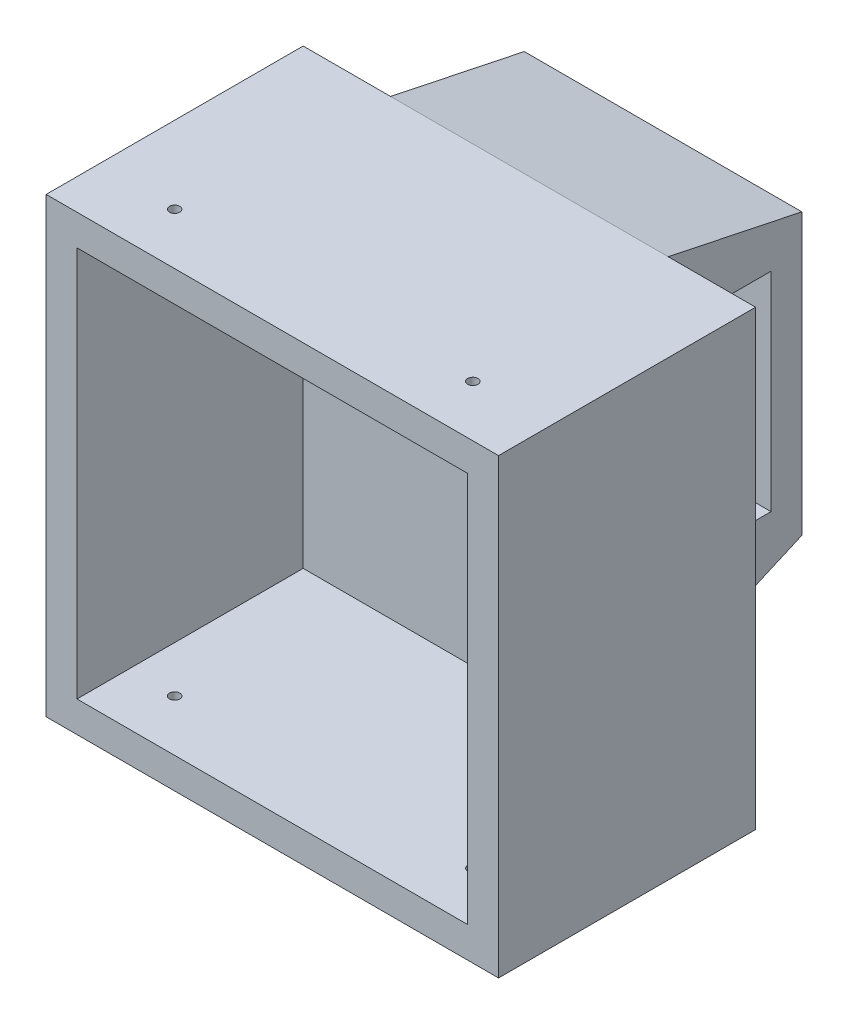
from build123d import *

# Parameters (mm, degrees)
ESQUISSE1_W             = 76
ESQUISSE1_H             = 76
BOSS_EXTRU_1_DEPTH      = 6
ESQUISSE3_W             = 76
ESQUISSE3_H             = 50
BOSS_EXTRU_2_DEPTH      = 6
ESQUISSE4_W             = 50
ESQUISSE4_H             = 82
BOSS_EXTRU_3_DEPTH      = 6
ESQUISSE5_W             = 50
ESQUISSE5_H             = 82
BOSS_EXTRU_4_DEPTH      = 6
ESQUISSE6_W             = 88
ESQUISSE6_H             = 50
BOSS_EXTRU_5_DEPTH      = 6
ESQUISSE8_W             = 54
ESQUISSE8_H             = 7
BOSS_EXTRU_6_DEPTH      = 26
ESQUISSE9_W             = 54
ESQUISSE9_H             = 6
BOSS_EXTRU_7_DEPTH      = 40.5
ESQUISSE11_W            = 54
ESQUISSE11_H            = 7
BOSS_EXTRU_8_DEPTH      = 26
BOSS_EXTRU_10_DEPTH     = 54
ESQUISSE13_R            = 1
ENL_V_MAT_EXTRU_1_DEPTH = 100


with BuildPart() as part:
    # Esquisse1 → Boss.-Extru.1 (new body)
    with BuildSketch(Plane.XY):
        with Locations((-3, -3)):
            Rectangle(ESQUISSE1_W, ESQUISSE1_H)
    extrude(amount=BOSS_EXTRU_1_DEPTH)

    # Esquisse3 → Boss.-Extru.2 (add)
    with BuildSketch(Plane(origin=(0, -41, 0), x_dir=(-1, 0, 0), z_dir=(0, -1, 0))):
        with Locations((3, -25)):
            Rectangle(ESQUISSE3_W, ESQUISSE3_H)
    extrude(amount=BOSS_EXTRU_2_DEPTH)

    # Esquisse4 → Boss.-Extru.3 (add)
    with BuildSketch(Plane.ZY.offset(41)):
        with Locations((25, -6)):
            Rectangle(ESQUISSE4_W, ESQUISSE4_H)
    extrude(amount=BOSS_EXTRU_3_DEPTH)

    # Esquisse5 → Boss.-Extru.4 (add)
    with BuildSketch(Plane(origin=(35, 0, 0), x_dir=(0, 0, -1), z_dir=(1, 0, 0))):
        with Locations((-25, -6)):
            Rectangle(ESQUISSE5_W, ESQUISSE5_H)
    extrude(amount=BOSS_EXTRU_4_DEPTH)

    # Esquisse6 → Boss.-Extru.5 (add)
    with BuildSketch(Plane(origin=(0, 35, 0), x_dir=(1, 0, 0), z_dir=(0, 1, 0))):
        with Locations((-3, -25)):
            Rectangle(ESQUISSE6_W, ESQUISSE6_H)
    extrude(amount=BOSS_EXTRU_5_DEPTH)

    # Esquisse8 → Boss.-Extru.6 (add)
    with BuildSketch(Plane(origin=(0, 0, 0), x_dir=(-1, 0, 0), z_dir=(0, 0, -1))):
        with Locations((3, 32.065521745)):
            Rectangle(ESQUISSE8_W, ESQUISSE8_H)
    extrude(amount=BOSS_EXTRU_6_DEPTH)

    # Esquisse9 → Boss.-Extru.7 (add)
    with BuildSketch(Plane(origin=(0, 28.565521745, 0), x_dir=(-1, 0, 0), z_dir=(0, -1, 0))):
        with Locations((3, 23)):
            Rectangle(ESQUISSE9_W, ESQUISSE9_H)
    extrude(amount=BOSS_EXTRU_7_DEPTH)

    # Esquisse11 → Boss.-Extru.8 (add)
    with BuildSketch(Plane(origin=(0, 0, -26), x_dir=(-1, 0, 0), z_dir=(0, 0, -1))):
        with Locations((3, -15.434478255)):
            Rectangle(ESQUISSE11_W, ESQUISSE11_H)
    extrude(amount=-BOSS_EXTRU_8_DEPTH)

    # Esquisse12 → Boss.-Extru.10 (add)
    with BuildSketch(Plane(origin=(24, 0, 0), x_dir=(0, 0, -1), z_dir=(1, 0, 0))):
        Polygon((26, -18.934478255), (0, -18.934478255), (0, -30.364478255), align=None)
        Polygon((0, 35.565521745), (26, 35.565521745), (0, 41), align=None)
    extrude(amount=-BOSS_EXTRU_10_DEPTH)

    # Esquisse13 → Enlèv. mat.-Extru.1 (cut)
    with BuildSketch(Plane(origin=(0, -47, 0), x_dir=(-1, 0, 0), z_dir=(0, -1, 0))):
        with Locations(Location((-26, -40, 0), (0, 0, 90))):
            Circle(ESQUISSE13_R)
        with Locations(Location((32, -40, 0), (0, 0, 90))):
            Circle(ESQUISSE13_R)
    extrude(amount=-ENL_V_MAT_EXTRU_1_DEPTH, mode=Mode.SUBTRACT)


solid = part.part
